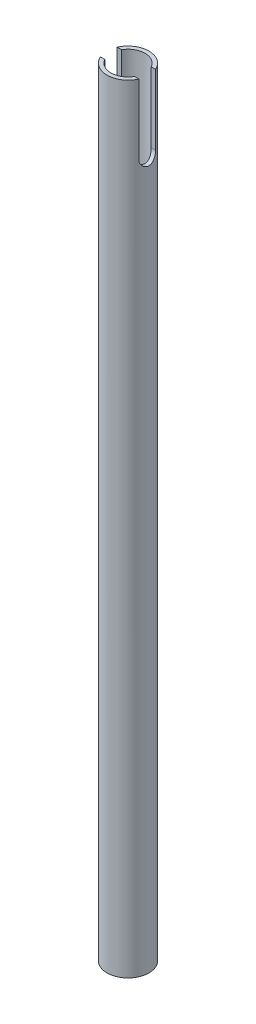
from build123d import *

# Parameters (mm, degrees)
SKETCH1_R               = 7.9375
SKETCH1_R_2             = 6.4643
BOSS_EXTRUDE1_DEPTH     = 294.838886828
CUT_EXTRUDE1_DEPTH      = 296.052498716
CUT_EXTRUDE1_DEPTH_BACK = 296.052498716


with BuildPart() as part:
    # Sketch1 → Boss-Extrude1 (new body)
    with BuildSketch(Plane(origin=(0, 0, 0), x_dir=(1, 0, 0), z_dir=(0, 1, 0))):
        with Locations(Location((0, 0, 0), (0, 0, 270))):
            Circle(SKETCH1_R)
        with Locations(Location((0, 0, 0), (0, 0, 270))):
            Circle(SKETCH1_R_2, mode=Mode.SUBTRACT)
    extrude(amount=BOSS_EXTRUDE1_DEPTH)

    # Sketch4 → Cut-Extrude1 (cut, two sides: drawn at the far end of the back side and taken through both)
    with BuildSketch(Plane(origin=(0, 0, 0), x_dir=(0, 0, -1), z_dir=(1, 0, 0)).offset(-CUT_EXTRUDE1_DEPTH_BACK)):
        with BuildLine():
            Line((3.175, 319.083660055), (3.175, 268.283660055))
            ThreePointArc((3.175, 268.283660055), (0, 265.108660055), (-3.175, 268.283660055))
            Line((-3.175, 268.283660055), (-3.175, 319.083660055))
            ThreePointArc((-3.175, 319.083660055), (0, 322.258660055), (3.175, 319.083660055))
        make_face()
    extrude(amount=CUT_EXTRUDE1_DEPTH + CUT_EXTRUDE1_DEPTH_BACK, mode=Mode.SUBTRACT)


solid = part.part
